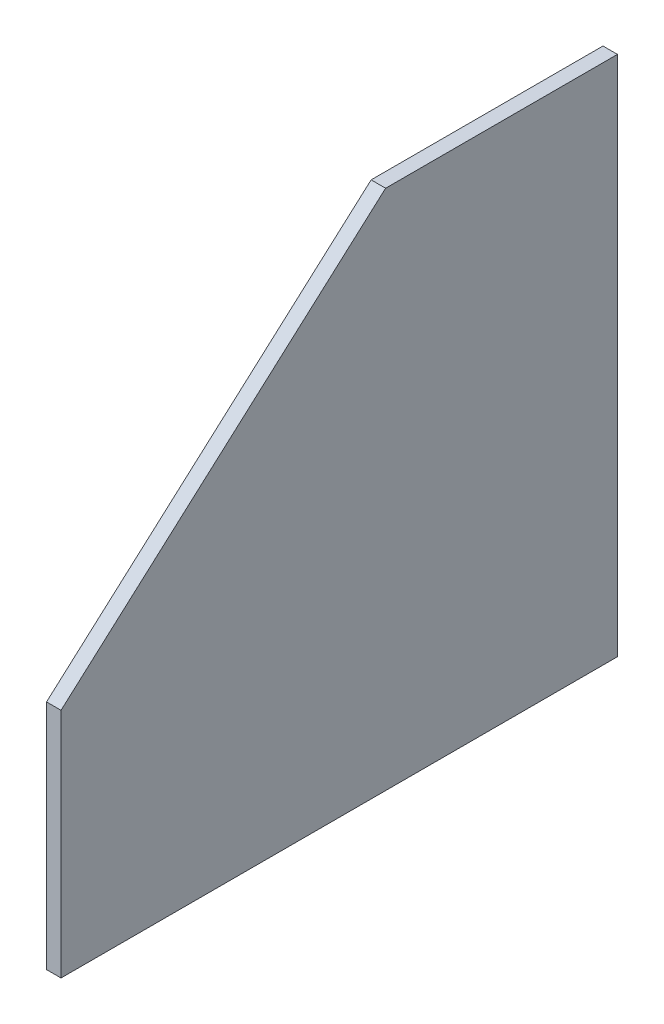
from build123d import *

# Parameters (mm, degrees)
BOSS_EXTRUDE1_DEPTH = 3.175


with BuildPart() as part:
    # Sketch1 → Boss-Extrude1 (new body)
    with BuildSketch(Plane(origin=(0, 0, 0), x_dir=(0, 0, -1), z_dir=(1, 0, 0))):
        Polygon((0, 0), (0, 114.3), (-50.8, 114.3), (-121.92, 50.8), (-121.92, 0), align=None)
    extrude(amount=BOSS_EXTRUDE1_DEPTH)


solid = part.part
